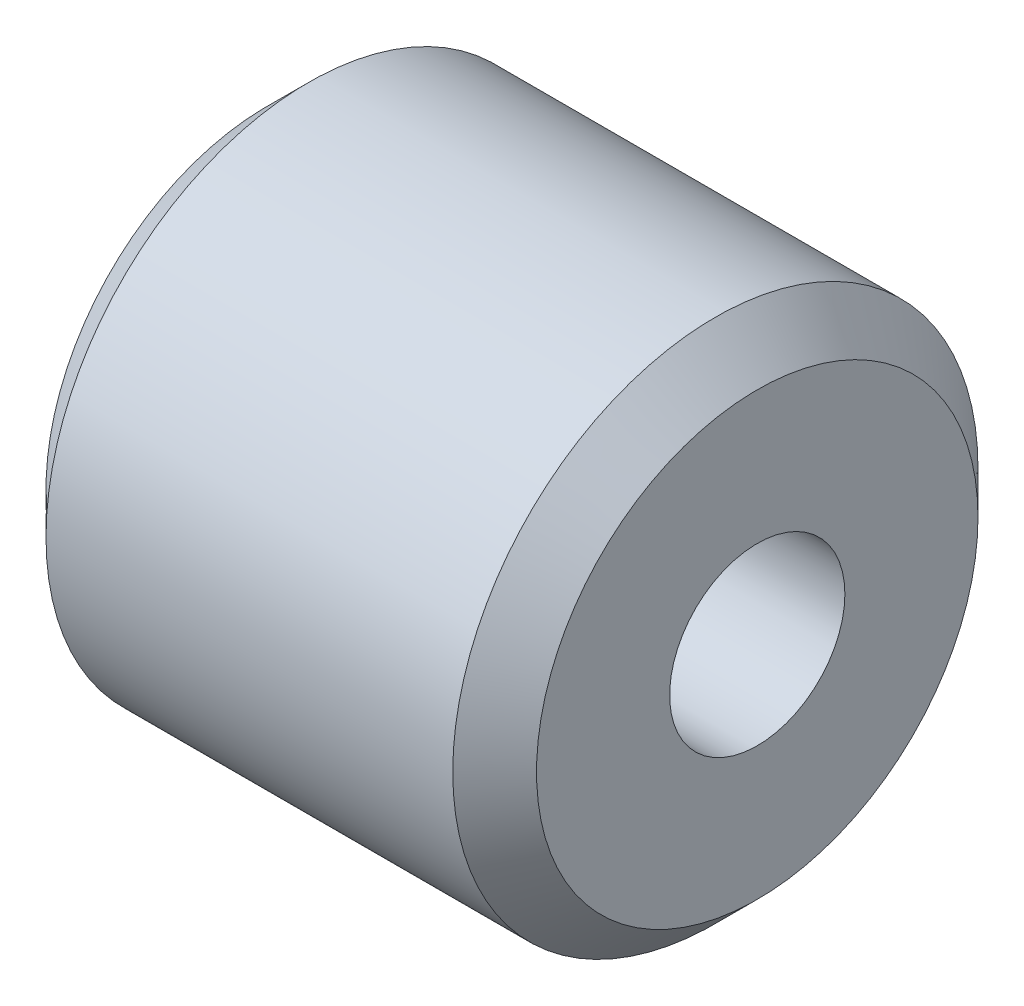
from build123d import *

# Parameters (mm, degrees)
SKETCH1_R           = 4.765
SKETCH1_R_2         = 1.59
BOSS_EXTRUDE1_DEPTH = 4.45
CHAMFER1_SIZE       = 0.76


with BuildPart() as part:
    # Sketch1 → Boss-Extrude1 (new, symmetric)
    with BuildSketch(Plane(origin=(0, 0, 0), x_dir=(0, 0, -1), z_dir=(1, 0, 0))):
        Circle(SKETCH1_R)
        Circle(SKETCH1_R_2, mode=Mode.SUBTRACT)
    extrude(amount=BOSS_EXTRUDE1_DEPTH, both=True)

    # Chamfer1
    chamfer1_edges = [part.edges().sort_by_distance(p)[0] for p in [
        (-4.45, 0, 4.765),
        (4.45, 0, 4.765),
    ]]
    chamfer(chamfer1_edges, length=CHAMFER1_SIZE)


solid = part.part
